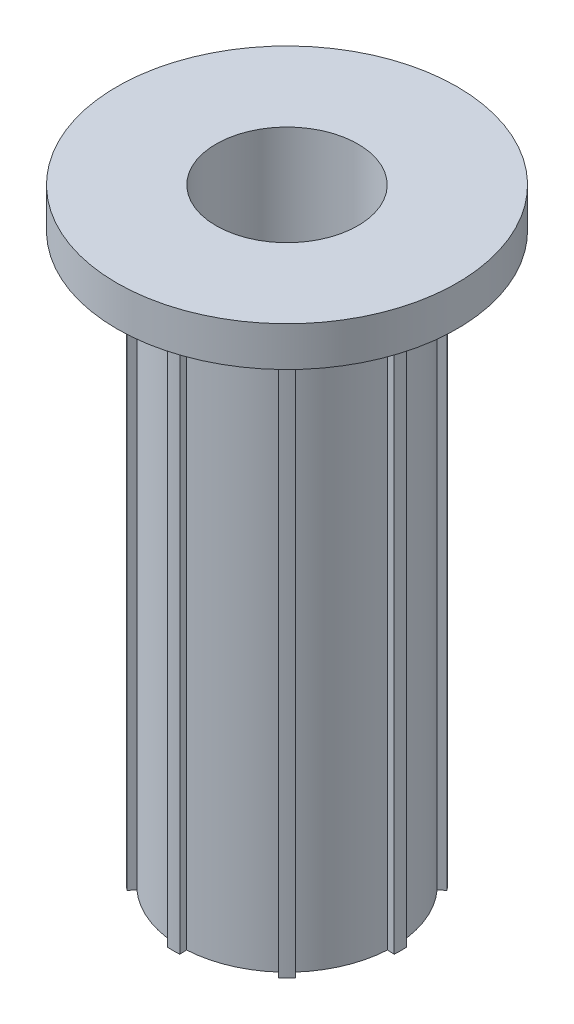
from build123d import *

# Parameters (mm, degrees)
SKETCH2_R           = 5.08
BOSS_EXTRUDE1_DEPTH = 25.4
SKETCH4_R           = 7.62
BOSS_EXTRUDE2_DEPTH = 1.778
SKETCH5_R           = 3.175
CUT_EXTRUDE2_DEPTH  = 30.236492334
CUT_EXTRUDE3_DEPTH  = 25.4


with BuildPart() as part:
    # Sketch2 → Boss-Extrude1 (new body)
    with BuildSketch(Plane(origin=(0, 0, 0), x_dir=(1, 0, 0), z_dir=(0, 1, 0))):
        with Locations(Location((0, 0, 0), (0, 0, 270))):
            Circle(SKETCH2_R)
    extrude(amount=BOSS_EXTRUDE1_DEPTH)

    # Sketch4 → Boss-Extrude2 (add)
    with BuildSketch(Plane(origin=(0, 25.4, 0), x_dir=(1, 0, 0), z_dir=(0, 1, 0))):
        with Locations(Location((0, 0, 0), (0, 0, 270))):
            Circle(SKETCH4_R)
    extrude(amount=BOSS_EXTRUDE2_DEPTH)

    # Sketch5 → Cut-Extrude2 (cut, through all)
    with BuildSketch(Plane(origin=(0, 27.178, 0), x_dir=(1, 0, 0), z_dir=(0, 1, 0))):
        with Locations(Location((0, 0, 0), (0, 0, 270))):
            Circle(SKETCH5_R)
    extrude(amount=-CUT_EXTRUDE2_DEPTH, mode=Mode.SUBTRACT)

    # Sketch6 → Cut-Extrude3 (cut)
    with BuildSketch(Plane.XZ):
        with BuildLine():
            Line((-3.77856884, 3.395411245), (-3.542408287, 3.183198042))
            ThreePointArc((-3.542408287, 3.183198042), (-4.399976274, 1.822529847), (-4.755721843, 0.254))
            Line((-4.755721843, 0.254), (-5.072769966, 0.270933333))
            ThreePointArc((-5.072769966, 0.270933333), (-4.693308025, 1.944031836), (-3.77856884, 3.395411245))
        make_face()
        with BuildLine():
            Line((-0.270933333, 5.072769966), (-0.254, 4.755721843))
            ThreePointArc((-0.254, 4.755721843), (-1.822529847, 4.399976274), (-3.183198042, 3.542408287))
            Line((-3.183198042, 3.542408287), (-3.395411245, 3.77856884))
            ThreePointArc((-3.395411245, 3.77856884), (-1.944031836, 4.693308025), (-0.270933333, 5.072769966))
        make_face()
        with BuildLine():
            Line((0.270933333, 5.072769966), (0.254, 4.755721843))
            ThreePointArc((0.254, 4.755721843), (1.822529847, 4.399976274), (3.183198042, 3.542408287))
            Line((3.183198042, 3.542408287), (3.395411245, 3.77856884))
            ThreePointArc((3.395411245, 3.77856884), (1.944031836, 4.693308025), (0.270933333, 5.072769966))
        make_face()
        with BuildLine():
            Line((3.77856884, 3.395411245), (3.542408287, 3.183198042))
            ThreePointArc((3.542408287, 3.183198042), (4.399976274, 1.822529847), (4.755721843, 0.254))
            Line((4.755721843, 0.254), (5.072769966, 0.270933333))
            ThreePointArc((5.072769966, 0.270933333), (4.693308025, 1.944031836), (3.77856884, 3.395411245))
        make_face()
        with BuildLine():
            Line((5.072769966, -0.270933333), (4.755721843, -0.254))
            ThreePointArc((4.755721843, -0.254), (4.399976274, -1.822529847), (3.542408287, -3.183198042))
            Line((3.542408287, -3.183198042), (3.77856884, -3.395411245))
            ThreePointArc((3.77856884, -3.395411245), (4.693308025, -1.944031836), (5.072769966, -0.270933333))
        make_face()
        with BuildLine():
            Line((3.183198042, -3.542408287), (3.395411245, -3.77856884))
            ThreePointArc((3.395411245, -3.77856884), (1.944031836, -4.693308025), (0.270933333, -5.072769966))
            Line((0.270933333, -5.072769966), (0.254, -4.755721843))
            ThreePointArc((0.254, -4.755721843), (1.822529847, -4.399976274), (3.183198042, -3.542408287))
        make_face()
        with BuildLine():
            Line((-4.755721843, -0.254), (-5.072769966, -0.270933333))
            ThreePointArc((-5.072769966, -0.270933333), (-4.693308025, -1.944031836), (-3.77856884, -3.395411245))
            Line((-3.77856884, -3.395411245), (-3.542408287, -3.183198042))
            ThreePointArc((-3.542408287, -3.183198042), (-4.399976274, -1.822529847), (-4.755721843, -0.254))
        make_face()
        with BuildLine():
            Line((-3.183198042, -3.542408287), (-3.395411245, -3.77856884))
            ThreePointArc((-3.395411245, -3.77856884), (-1.944031836, -4.693308025), (-0.270933333, -5.072769966))
            Line((-0.270933333, -5.072769966), (-0.254, -4.755721843))
            ThreePointArc((-0.254, -4.755721843), (-1.822529847, -4.399976274), (-3.183198042, -3.542408287))
        make_face()
    extrude(amount=-CUT_EXTRUDE3_DEPTH, mode=Mode.SUBTRACT)


solid = part.part
